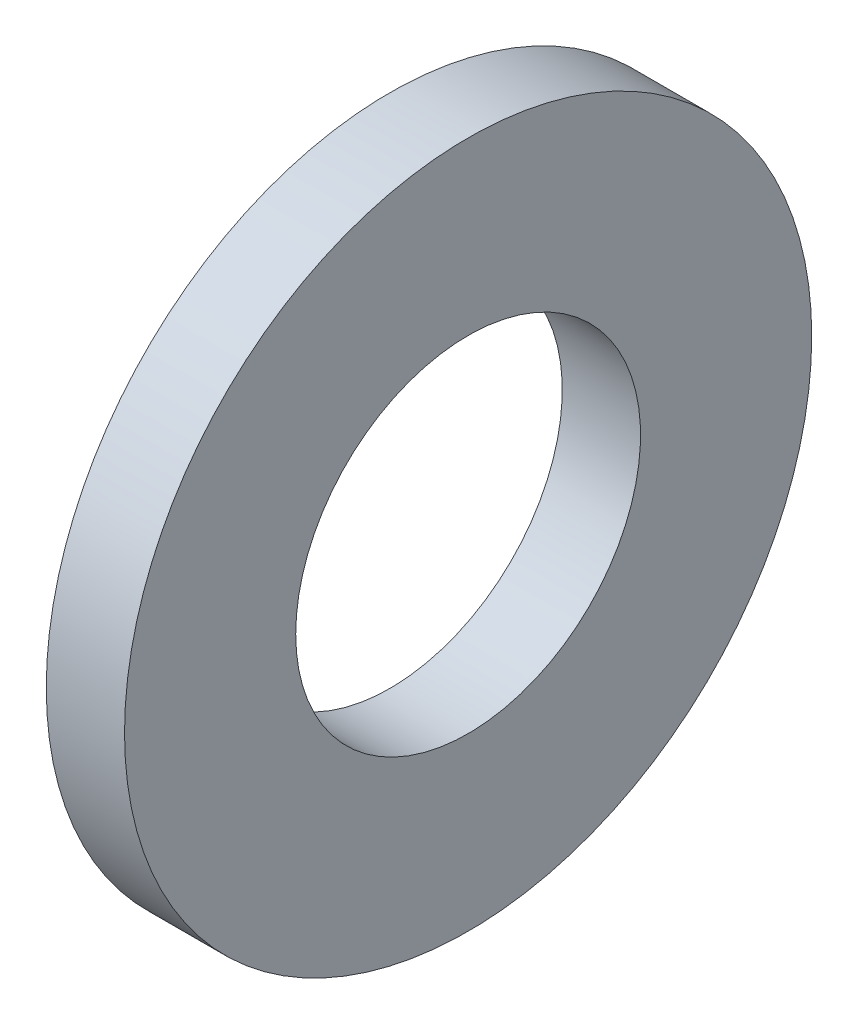
from build123d import *

# Parameters (mm, degrees)
SKETCH1_W = 0.8128
SKETCH1_H = 1.778


with BuildPart() as part:
    # Sketch1 → Base-Revolve (revolve)
    with BuildSketch(Plane.XY, mode=Mode.PRIVATE) as base_revolve_sk:
        with Locations((-0.4064, 2.6797)):
            Rectangle(SKETCH1_W, SKETCH1_H)
    revolve(base_revolve_sk.sketch.rotate(Axis((-34.925, 0, 0), (1, 0, 0)), 90), axis=Axis((-34.925, 0, 0), (1, 0, 0)))


solid = part.part
